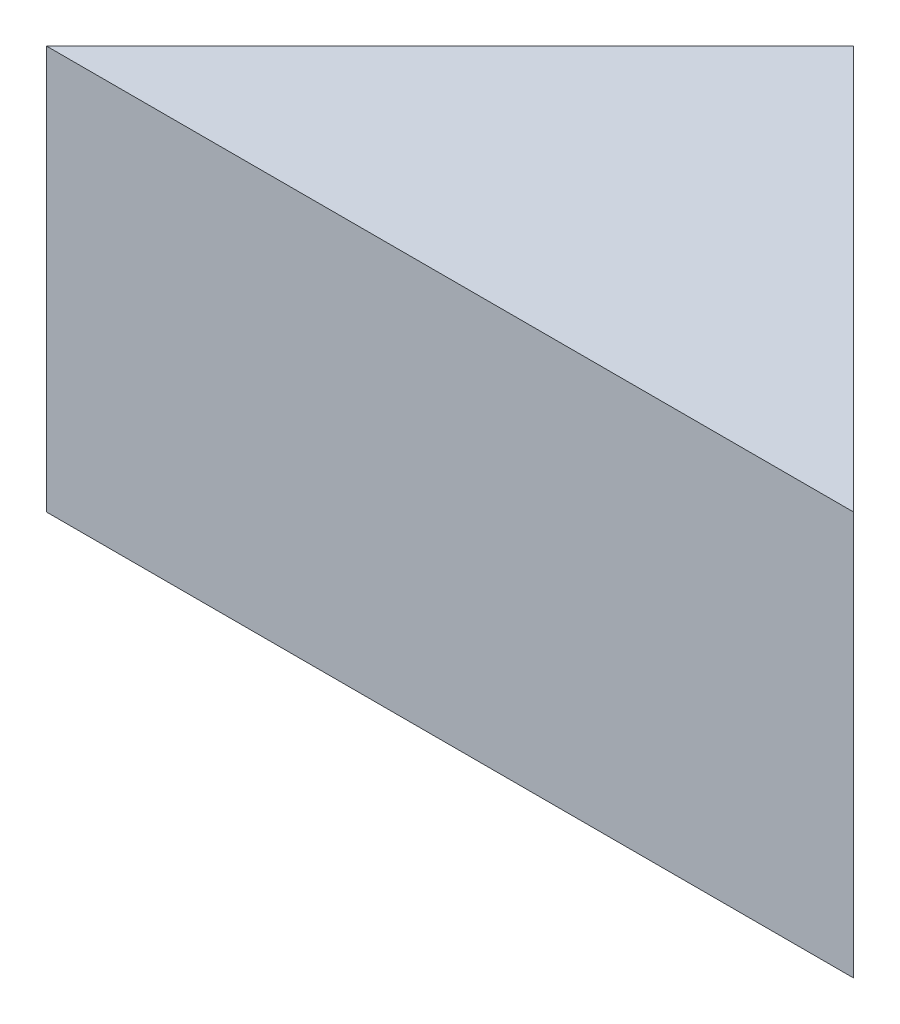
from build123d import *

# Parameters (mm, degrees)
BOSS_EXTRUDE1_DEPTH = 20


with BuildPart() as part:
    # Sketch1 → Boss-Extrude1 (new body)
    with BuildSketch(Plane(origin=(0, 0, 0), x_dir=(1, 0, 0), z_dir=(0, 1, 0))):
        Polygon((0, 20), (-20, 0), (0, 0), align=None)
        Polygon((0, 20), (0, 0), (20, 0), align=None)
    extrude(amount=BOSS_EXTRUDE1_DEPTH)


solid = part.part
